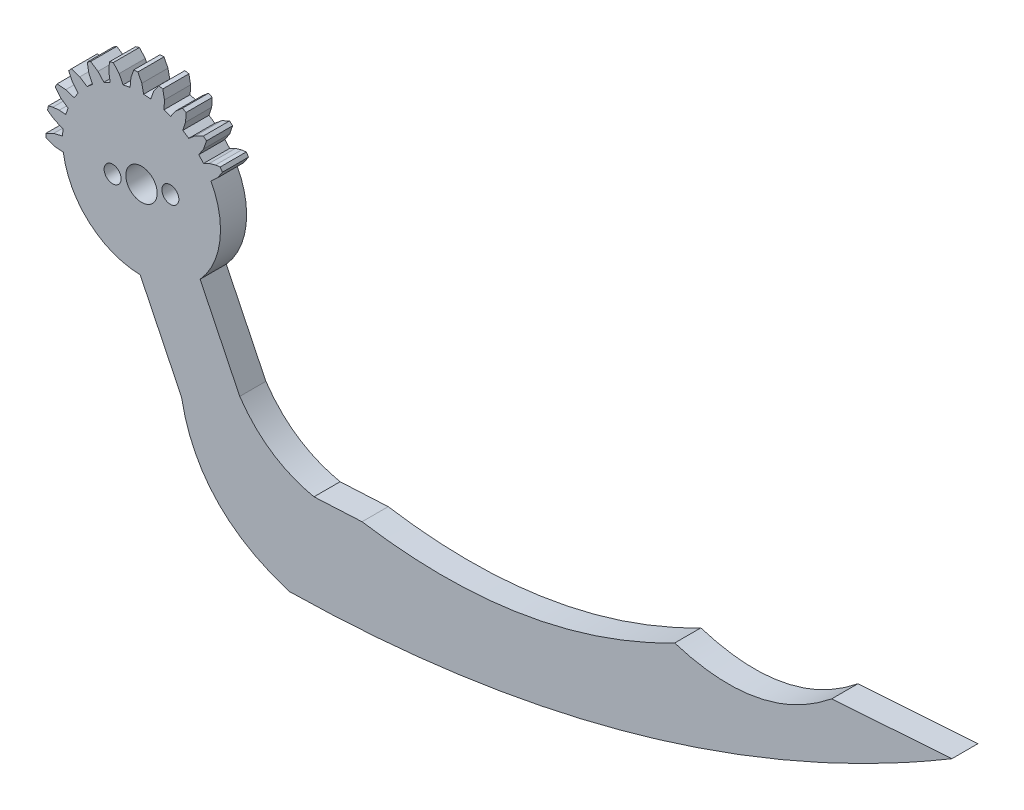
from build123d import *

# Parameters (mm, degrees)
SKETCH1_W           = 150
SKETCH1_H           = 70
BOSS_EXTRUDE1_DEPTH = 4
SKETCH2_W           = 150
SKETCH2_H           = 70
SKETCH2_R           = 1.3
SKETCH2_R_2         = 2.4
CUT_EXTRUDE1_DEPTH  = 10


with BuildPart() as part:
    # Sketch1 → Boss-Extrude1 (new body)
    with BuildSketch(Plane.XY):
        Rectangle(SKETCH1_W, SKETCH1_H)
    extrude(amount=BOSS_EXTRUDE1_DEPTH)

    # Sketch2 → Cut-Extrude1 (cut)
    # profile 1 of 4: a face of its own
    with BuildSketch(Plane.XY.offset(4)):
        Rectangle(SKETCH2_W, SKETCH2_H)
        with BuildLine():
            add(Edge.make_bspline(
                [(25.943186653, -3.950471355), (27.846969269, -4.547232813), (31.287122421, -5.290525852), (36.735640075, -5.338112806), (41.143250704, -4.366496225), (45.771671446, -2.369991596), (48.378055128, -0.634767364), (49.984542654, 0.667670418)],
                knots=[0, 0, 0, 0, 0.234141345, 0.410073985, 0.635494837, 0.757255977, 1, 1, 1, 1], degree=3))
            Line((49.984542654, 0.667670418), (68.368403063, 1.920292741))
            add(Edge.make_bspline(
                [(-33.004955139, -26.618623378), (-30.294523128, -26.574879913), (-25.880509709, -26.423954366), (-19.54201722, -26.014521717), (-14.319937046, -25.543432562), (-8.998131049, -24.92772797), (-2.890101028, -24.067514059), (4.364427962, -22.796901426), (11.870157255, -21.159659498), (19.827939937, -19.110263295), (26.884456831, -16.979260605), (34.037553038, -14.503385048), (39.936366025, -12.243402206), (45.782494162, -9.778756125), (51.423398212, -7.197801789), (59.009760326, -3.437427178), (64.682537278, -0.280517491), (68.368403063, 1.920292741)],
                knots=[0, 0, 0, 0, 0.076324938, 0.124331496, 0.178823517, 0.223936737, 0.275160112, 0.352480577, 0.431247301, 0.491394905, 0.583819579, 0.638693956, 0.704497251, 0.761639539, 0.81730198, 0.879134072, 1, 1, 1, 1], degree=3))
            add(Edge.make_bspline(
                [(-49.535748672, -9.096126268), (-49.339830369, -10.137896023), (-48.797352048, -12.328019472), (-47.539705157, -15.420109206), (-45.707187417, -18.401147763), (-43.54343584, -20.831673927), (-40.91315221, -22.974076428), (-37.51630052, -25.005074849), (-34.707117005, -26.096270898), (-33.004955139, -26.618623378)],
                knots=[0, 0, 0, 0, 0.124884489, 0.26543712, 0.391415345, 0.535530604, 0.646519487, 0.79009791, 1, 1, 1, 1], degree=3))
            Line((-49.535748672, -9.096126268), (-55.868573385, 3.961128214))
            ThreePointArc((-55.868573385, 3.961128214), (-63.649841308, 6.972432766), (-67.628790007, 14.306193932))
            Line((-67.628790007, 14.306193932), (-68.970840738, 14.428927947))
            Line((-68.970840738, 14.428927947), (-70.240707474, 14.880151039))
            Line((-70.240707474, 14.880151039), (-70.277437725, 15.5032436))
            Line((-70.277437725, 15.5032436), (-69.069379214, 16.10053619))
            Line((-69.069379214, 16.10053619), (-67.751042994, 16.380095513))
            Line((-67.751042994, 16.380095513), (-67.679030495, 17.409843403))
            Line((-67.679030495, 17.409843403), (-68.386470931, 17.681135001))
            Line((-68.386470931, 17.681135001), (-69.26282403, 18.111750468))
            Line((-69.26282403, 18.111750468), (-70.047304849, 18.693140424))
            Line((-70.047304849, 18.693140424), (-69.921515326, 19.304508109))
            Line((-69.921515326, 19.304508109), (-69.22879013, 19.48592239))
            Line((-69.22879013, 19.48592239), (-68.242063209, 19.582780663))
            Line((-68.242063209, 19.582780663), (-67.254259433, 19.497602945))
            Line((-67.254259433, 19.497602945), (-66.898609662, 20.523128894))
            Line((-66.898609662, 20.523128894), (-67.999492681, 21.300445035))
            Line((-67.999492681, 21.300445035), (-68.873617988, 22.326149063))
            Line((-68.873617988, 22.326149063), (-68.593881038, 22.884128176))
            Line((-68.593881038, 22.884128176), (-67.249025383, 22.797369477))
            Line((-67.249025383, 22.797369477), (-65.967533065, 22.380306842))
            Line((-65.967533065, 22.380306842), (-65.358576119, 23.278839907))
            Line((-65.358576119, 23.278839907), (-66.220763237, 24.314599134))
            Line((-66.220763237, 24.314599134), (-66.799631709, 25.531593422))
            Line((-66.799631709, 25.531593422), (-66.385010944, 25.998158608))
            Line((-66.385010944, 25.998158608), (-65.108434938, 25.566281883))
            Line((-65.108434938, 25.566281883), (-63.978552164, 24.831755694))
            Line((-63.978552164, 24.831755694), (-63.157787454, 25.542062333))
            Line((-63.157787454, 25.542062333), (-63.722522044, 26.765679367))
            Line((-63.722522044, 26.765679367), (-63.966684751, 28.091027765))
            Line((-63.966684751, 28.091027765), (-63.44543589, 28.434383377))
            Line((-63.44543589, 28.434383377), (-62.324136078, 27.686820312))
            Line((-62.324136078, 27.686820312), (-61.422862493, 26.684887316))
            Line((-61.422862493, 26.684887316), (-60.446223776, 27.158561304))
            Line((-60.446223776, 27.158561304), (-60.675020109, 28.486648666))
            Line((-60.675020109, 28.486648666), (-60.567837768, 29.830030872))
            Line((-60.567837768, 29.830030872), (-59.975483059, 30.026777792))
            Line((-59.975483059, 30.026777792), (-59.08587417, 29.014473574))
            Line((-59.08587417, 29.014473574), (-58.474630079, 27.813413848))
            Line((-58.474630079, 27.813413848), (-57.40867367, 28.018175086))
            Line((-57.40867367, 28.018175086), (-57.285939655, 29.360225818))
            Line((-57.285939655, 29.360225818), (-56.834716563, 30.630092553))
            Line((-56.834716563, 30.630092553), (-56.211624002, 30.666822805))
            Line((-56.211624002, 30.666822805), (-55.614331412, 29.458764294))
            Line((-55.614331412, 29.458764294), (-55.334772089, 28.140428074))
            Line((-55.334772089, 28.140428074), (-54.252141156, 28.062322422))
            Line((-54.252141156, 28.062322422), (-53.786240912, 29.326877983))
            Line((-53.786240912, 29.326877983), (-53.021727178, 30.436689929))
            Line((-53.021727178, 30.436689929), (-52.410359493, 30.310900406))
            Line((-52.410359493, 30.310900406), (-52.146087704, 28.989414792))
            Line((-52.146087704, 28.989414792), (-52.217264657, 27.643644513))
            Line((-52.217264657, 27.643644513), (-51.191738708, 27.287994742))
            Line((-51.191738708, 27.287994742), (-50.414422567, 28.388877761))
            Line((-50.414422567, 28.388877761), (-49.388718539, 29.263003067))
            Line((-49.388718539, 29.263003067), (-48.830739426, 28.983266117))
            Line((-48.830739426, 28.983266117), (-48.917498125, 27.638410463))
            Line((-48.917498125, 27.638410463), (-49.33456076, 26.356918144))
            Line((-49.33456076, 26.356918144), (-48.436027695, 25.747961199))
            Line((-48.436027695, 25.747961199), (-47.400268467, 26.610148317))
            Line((-47.400268467, 26.610148317), (-46.18327418, 27.189016789))
            Line((-46.18327418, 27.189016789), (-45.716708994, 26.774396023))
            Line((-45.716708994, 26.774396023), (-46.148585719, 25.497820017))
            Line((-46.148585719, 25.497820017), (-46.883111907, 24.367937244))
            Line((-46.883111907, 24.367937244), (-46.172805269, 23.547172533))
            Line((-46.172805269, 23.547172533), (-45.286864939, 23.992280694))
            Line((-45.286864939, 23.992280694), (-44.334478382, 24.26790977))
            Line((-44.334478382, 24.26790977), (-43.623839837, 24.356069831))
            Line((-43.623839837, 24.356069831), (-43.280484225, 23.83482097))
            Line((-43.280484225, 23.83482097), (-44.02804729, 22.713521158))
            Line((-44.02804729, 22.713521158), (-45.029980286, 21.812247573))
            ThreePointArc((-45.029980286, 21.812247573), (-43.655526666, 14.616368623), (-46.687860181, 7.947429421))
            Line((-46.687860181, 7.947429421), (-40.625414849, -4.552346756))
            add(Edge.make_bspline(
                [(-40.625414849, -4.552346756), (-39.969724138, -5.518615353), (-38.642033006, -7.159979255), (-36.383256782, -9.119344727), (-34.181437855, -10.482492748), (-31.814725419, -11.517519607), (-30.173224961, -11.982812896), (-29.2632985, -12.178103902)],
                knots=[0, 0, 0, 0, 0.249608299, 0.449336056, 0.636249607, 0.801036873, 1, 1, 1, 1], degree=3))
            Line((-29.2632985, -12.178103902), (-21.905328426, -11.80268597))
            add(Edge.make_bspline(
                [(-21.905328426, -11.80268597), (-20.310852996, -12.055092712), (-17.169889797, -12.459787879), (-12.483928013, -12.782767249), (-8.045859096, -12.82243272), (-3.649062985, -12.608578219), (1.283313279, -12.08050338), (5.938716144, -11.233581759), (10.05540984, -10.206537199), (13.081948519, -9.312895411), (16.474512339, -8.1639354), (20.793643696, -6.464082533), (24.086370836, -4.909244471), (25.943186653, -3.950471355)],
                knots=[0, 0, 0, 0, 0.098157301, 0.192485818, 0.285432427, 0.367865586, 0.460021268, 0.586889267, 0.655198895, 0.717943591, 0.778718956, 0.872950297, 1, 1, 1, 1], degree=3))
        make_face(mode=Mode.SUBTRACT)
    # profile 2 of 4: a face of its own
    with BuildSketch(Plane.XY.offset(4)):
        with Locations((-60.081947299, 15.203234123)):
            Circle(SKETCH2_R)
    # profile 3 of 4: a face of its own
    with BuildSketch(Plane.XY.offset(4)):
        with Locations((-51.243535224, 16.901018558)):
            Circle(SKETCH2_R)
    # profile 4 of 4: a face of its own
    with BuildSketch(Plane.XY.offset(4)):
        with Locations((-55.662741261, 16.052126341)):
            Circle(SKETCH2_R_2)
    extrude(amount=-CUT_EXTRUDE1_DEPTH, mode=Mode.SUBTRACT)


solid = part.part
